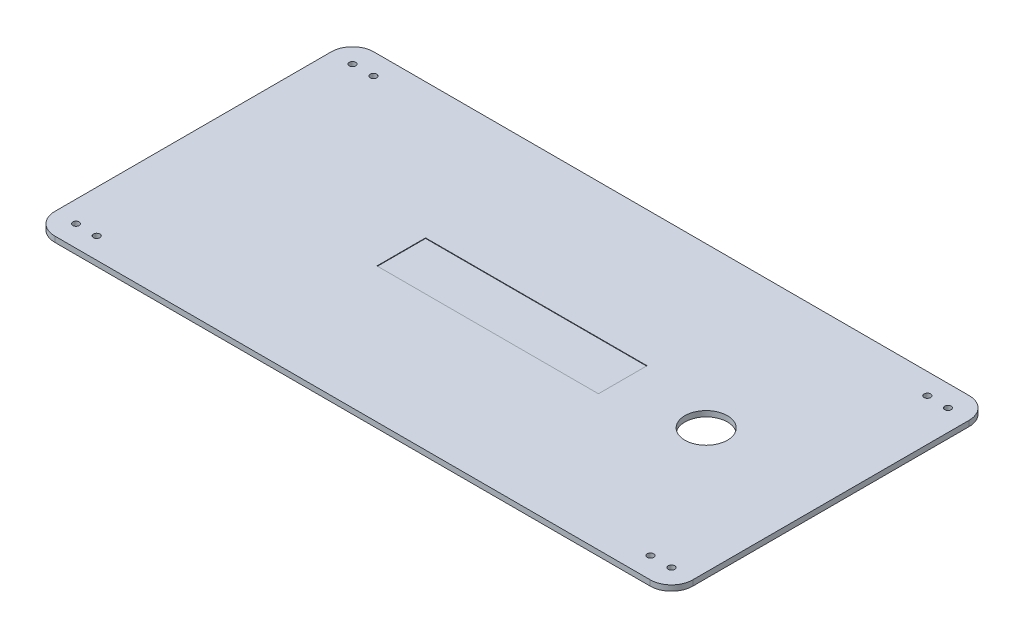
from build123d import *

# Parameters (mm, degrees)
SKETCH1_W               = 300
SKETCH1_H               = 150
BOSS_EXTRUDE1_DEPTH     = 2.6
FILLET1_R               = 10
SKETCH6_R               = 1.5
CUT_EXTRUDE6_DEPTH      = 2.6
MIRROR6_COPY_1_SKETCH_R = 1.5
MIRROR6_COPY_1_DEPTH    = 2.6
SKETCH23_R              = 1.524
CUT_EXTRUDE16_DEPTH     = 2.59999988
MIRROR8_COPY_1_SKETCH_R = 1.524
MIRROR8_COPY_1_DEPTH    = 2.59999988
SKETCH15_R              = 10
CUT_EXTRUDE19_DEPTH     = 336.420273687
SKETCH25_W              = 104.14
SKETCH25_H              = 22.86
CUT_EXTRUDE20_DEPTH     = 0.254


with BuildPart() as part:
    # Sketch1 → Boss-Extrude1 (new body)
    with BuildSketch(Plane(origin=(0, 0, 0), x_dir=(1, 0, 0), z_dir=(0, 1, 0))):
        with Locations((150, -75)):
            Rectangle(SKETCH1_W, SKETCH1_H)
    extrude(amount=BOSS_EXTRUDE1_DEPTH)

    # Fillet1
    fillet1_edges = [part.edges().sort_by_distance(p)[0] for p in [
        (0, 1.3, 0),
        (300, 1.3, 0),
        (300, 1.3, 150),
        (0, 1.3, 150),
    ]]
    fillet(fillet1_edges, radius=FILLET1_R)

    # Sketch6 → Cut-Extrude6 (cut)
    with BuildSketch(Plane.XZ):
        with Locations(Location((290, 10, 0), (0, 0, 270))):
            Circle(SKETCH6_R)
    cut_extrude6 = extrude(amount=-CUT_EXTRUDE6_DEPTH, mode=Mode.SUBTRACT)

    # Mirror5: Cut-Extrude6 across plane
    add(cut_extrude6.mirror(Plane(origin=(150, 0, 0), x_dir=(0, 0, 1), z_dir=(1, 0, 0))), mode=Mode.SUBTRACT)

    # Mirror6: Cut-Extrude6 across plane
    add(cut_extrude6.mirror(Plane.XY.offset(75)), mode=Mode.SUBTRACT)

    # Mirror6 copy 1 sketch → Mirror6 copy 1 (cut)
    with BuildSketch(Plane(origin=(300, 0, 150), x_dir=(-1, 0, 0), z_dir=(0, -1, 0))):
        with Locations(Location((290, 10, 0), (0, 0, 270))):
            Circle(MIRROR6_COPY_1_SKETCH_R)
    extrude(amount=-MIRROR6_COPY_1_DEPTH, mode=Mode.SUBTRACT)

    # Sketch23 → Cut-Extrude16 (cut)
    with BuildSketch(Plane(origin=(0, 2.6, 0), x_dir=(1, 0, 0), z_dir=(0, 1, 0))):
        with Locations(Location((19.812, -9.906, 0), (0, 0, 270))):
            Circle(SKETCH23_R)
    cut_extrude16 = extrude(amount=-CUT_EXTRUDE16_DEPTH, mode=Mode.SUBTRACT)

    # Mirror7: Cut-Extrude16 across plane
    add(cut_extrude16.mirror(Plane(origin=(150, 0, 0), x_dir=(0, 0, 1), z_dir=(1, 0, 0))), mode=Mode.SUBTRACT)

    # Mirror8: Cut-Extrude16 across plane
    add(cut_extrude16.mirror(Plane.XY.offset(75)), mode=Mode.SUBTRACT)

    # Mirror8 copy 1 sketch → Mirror8 copy 1 (cut)
    with BuildSketch(Plane(origin=(300, 2.6, 150), x_dir=(-1, 0, 0), z_dir=(0, 1, 0))):
        with Locations(Location((19.812, -9.906, 0), (0, 0, 270))):
            Circle(MIRROR8_COPY_1_SKETCH_R)
    extrude(amount=-MIRROR8_COPY_1_DEPTH, mode=Mode.SUBTRACT)

    # Sketch15 → Cut-Extrude19 (cut, through all)
    with BuildSketch(Plane.XZ):
        with Locations(Location((241.3, 75, 0), (0, 0, 270))):
            Circle(SKETCH15_R)
    extrude(amount=-CUT_EXTRUDE19_DEPTH, mode=Mode.SUBTRACT)

    # Sketch25 → Cut-Extrude20 (cut)
    with BuildSketch(Plane(origin=(0, 2.6, 0), x_dir=(1, 0, 0), z_dir=(0, 1, 0))):
        with Locations((150, -75)):
            Rectangle(SKETCH25_W, SKETCH25_H)
    extrude(amount=-CUT_EXTRUDE20_DEPTH, mode=Mode.SUBTRACT)


solid = part.part
